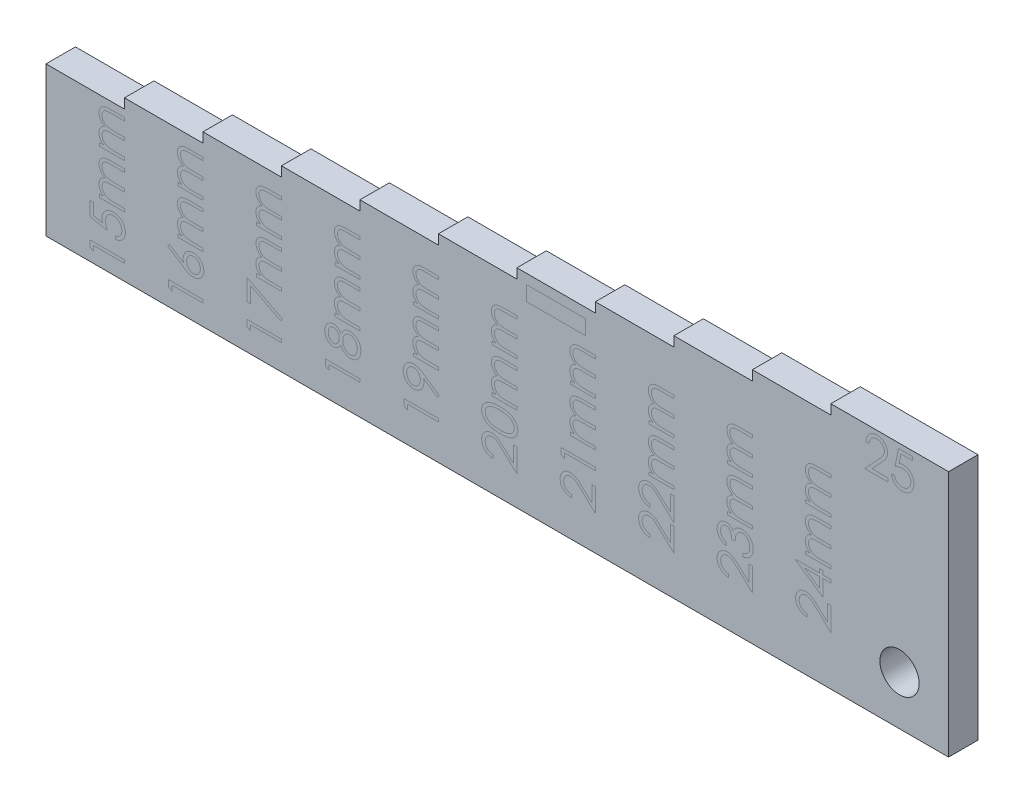
from build123d import *

# Parameters (mm, degrees)
SKETCH1_R           = 2
BOSS_EXTRUDE1_DEPTH = 3


with BuildPart() as part:
    # Sketch1 → Boss-Extrude1 (new body)
    with BuildSketch(Plane.XY):
        Polygon((0, 0), (0, 25.2), (-12, 25.2), (-12, 24.2), (-20, 24.2), (-20, 23.2), (-28, 23.2), (-28, 22.2), (-36, 22.2), (-36, 21.2), (-44, 21.2), (-44, 20.2), (-52, 20.2), (-52, 19.2), (-60, 19.2), (-60, 18.2), (-68, 18.2), (-68, 17.2), (-76, 17.2), (-76, 16.2), (-84, 16.2), (-84, 15.2), (-92, 15.2), (-92, 0), align=None)
        with Locations((-5, 5)):
            Circle(SKETCH1_R, mode=Mode.SUBTRACT)
    extrude(amount=BOSS_EXTRUDE1_DEPTH)


solid = part.part
